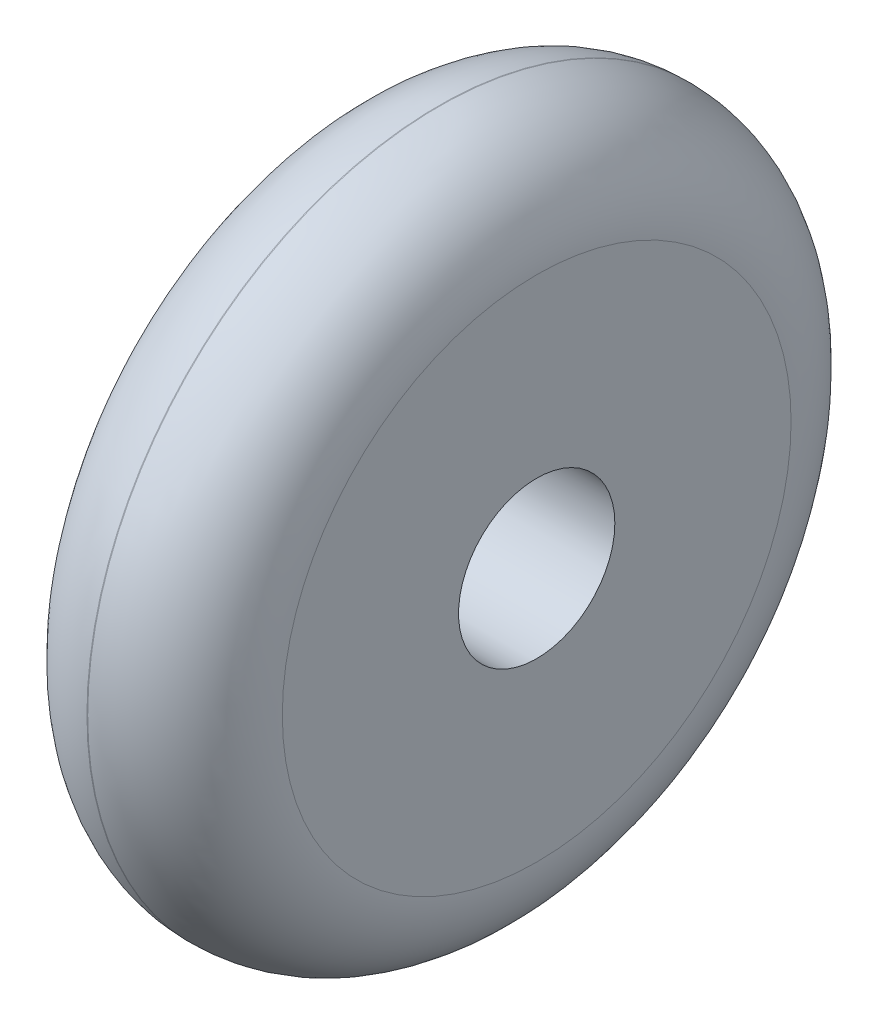
from build123d import *

# Parameters (mm, degrees)
SKETCH2_R           = 9
SKETCH2_R_2         = 2
BOSS_EXTRUDE1_DEPTH = 5
FILLET1_R           = 2.49


with BuildPart() as part:
    # Sketch2 → Boss-Extrude1 (new body)
    with BuildSketch(Plane(origin=(0, 0, 0), x_dir=(0, 0, -1), z_dir=(1, 0, 0))):
        Circle(SKETCH2_R)
        Circle(SKETCH2_R_2, mode=Mode.SUBTRACT)
    extrude(amount=BOSS_EXTRUDE1_DEPTH)

    # Fillet1
    fillet1_edges = [part.edges().sort_by_distance(p)[0] for p in [
        (0, 0, 9),
        (5, 0, 9),
    ]]
    fillet(fillet1_edges, radius=FILLET1_R)


solid = part.part
